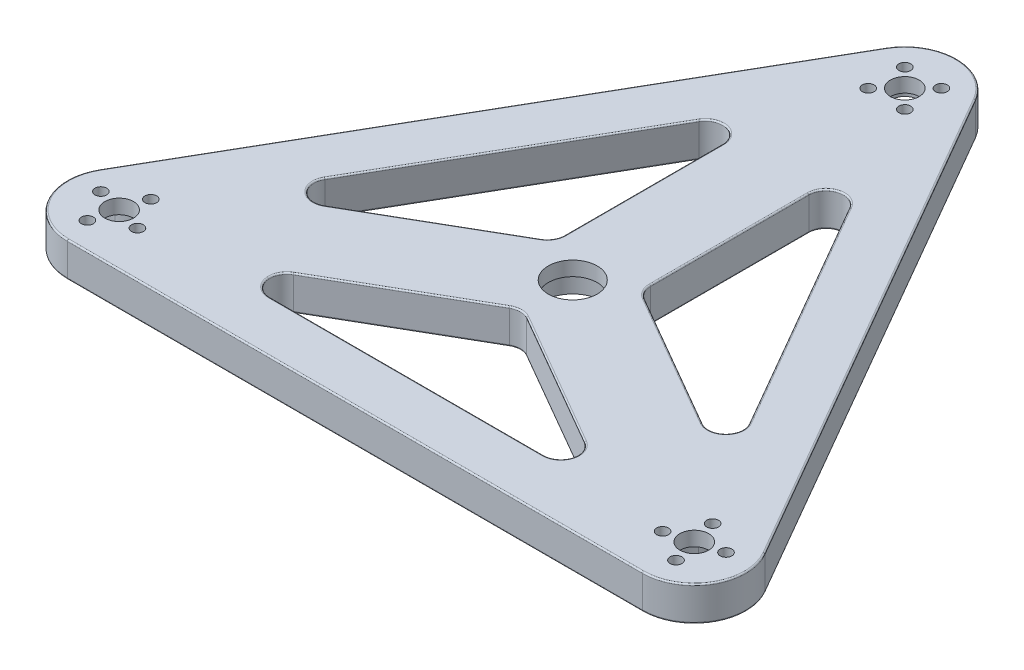
from build123d import *

# Parameters (mm, degrees)
SKETCH1_R           = 5
SKETCH1_R_2         = 8.5
SKETCH1_R_3         = 2.05
BOSS_EXTRUDE1_DEPTH = 12
SKETCH1_3_R         = 5
SKETCH1_3_R_2       = 2.05
SKETCH1_3_R_3       = 11
SKETCH1_3_R_4       = 8.5
CUT_EXTRUDE1_DEPTH  = 7
FILLET1_R           = 6
FILLET2_R           = 0.5


with BuildPart() as part:
    # Sketch1 → Boss-Extrude1 (new body)
    with BuildSketch(Plane(origin=(0, 0, 0), x_dir=(1, 0, 0), z_dir=(0, 1, 0))):
        with BuildLine():
            ThreePointArc((15.588457268, 124.470053838), (0, 133.470053838), (-15.588457268, 124.470053838))
            Line((-15.588457268, 124.470053838), (-115.588457268, -48.735026919))
            ThreePointArc((-115.588457268, -48.735026919), (-115.588457268, -66.735026919), (-100, -75.735026919))
            Line((-100, -75.735026919), (100, -75.735026919))
            ThreePointArc((100, -75.735026919), (115.588457268, -66.735026919), (115.588457268, -48.735026919))
            Line((115.588457268, -48.735026919), (15.588457268, 124.470053838))
        make_face()
        Polygon((70, -57.735026919), (-70, -57.735026919), (0, -17.320508076), align=None, mode=Mode.SUBTRACT)
        Polygon((-85, -31.754264805), (-15, 89.489291724), (-15, 8.660254038), align=None, mode=Mode.SUBTRACT)
        Polygon((15, 8.660254038), (15, 89.489291724), (85, -31.754264805), align=None, mode=Mode.SUBTRACT)
        with Locations((-100, -57.735026919)):
            Circle(SKETCH1_R, mode=Mode.SUBTRACT)
        Circle(SKETCH1_R_2, mode=Mode.SUBTRACT)
        with Locations((100, -57.735026919)):
            Circle(SKETCH1_R, mode=Mode.SUBTRACT)
        with Locations((0, 115.470053838)):
            Circle(SKETCH1_R, mode=Mode.SUBTRACT)
        with Locations((-91.306667563, -60.064398325)):
            Circle(SKETCH1_R_3, mode=Mode.SUBTRACT)
        with Locations((-97.670628594, -49.041694482)):
            Circle(SKETCH1_R_3, mode=Mode.SUBTRACT)
        with Locations((-102.329371406, -66.428359356)):
            Circle(SKETCH1_R_3, mode=Mode.SUBTRACT)
        with Locations((-108.693332437, -55.405655513)):
            Circle(SKETCH1_R_3, mode=Mode.SUBTRACT)
        with Locations((108.693332437, -55.405655513)):
            Circle(SKETCH1_R_3, mode=Mode.SUBTRACT)
        with Locations((97.670628594, -49.041694482)):
            Circle(SKETCH1_R_3, mode=Mode.SUBTRACT)
        with Locations((102.329371406, -66.428359356)):
            Circle(SKETCH1_R_3, mode=Mode.SUBTRACT)
        with Locations((91.306667563, -60.064398325)):
            Circle(SKETCH1_R_3, mode=Mode.SUBTRACT)
        with Locations((-6.363961031, 109.106092807)):
            Circle(SKETCH1_R_3, mode=Mode.SUBTRACT)
        with Locations((6.363961031, 109.106092807)):
            Circle(SKETCH1_R_3, mode=Mode.SUBTRACT)
        with Locations((6.363961031, 121.834014869)):
            Circle(SKETCH1_R_3, mode=Mode.SUBTRACT)
        with Locations((-6.363961031, 121.834014869)):
            Circle(SKETCH1_R_3, mode=Mode.SUBTRACT)
    extrude(amount=BOSS_EXTRUDE1_DEPTH)

    # Sketch1<3> → Cut-Extrude1 (cut)
    # profile 1 of 4: a face of its own
    with BuildSketch(Plane(origin=(0, 0, 0), x_dir=(1, 0, 0), z_dir=(0, 1, 0))):
        with BuildLine():
            ThreePointArc((3.737372338, 105.452186426), (9.545941546, 105.924112292), (10.017867412, 111.7326815))
            ThreePointArc((10.017867412, 111.7326815), (8.813961031, 115.470053838), (10.017867412, 119.207426176))
            ThreePointArc((10.017867412, 119.207426176), (9.545941546, 125.015995384), (3.737372338, 125.48792125))
            ThreePointArc((3.737372338, 125.48792125), (0, 124.284014869), (-3.737372338, 125.48792125))
            ThreePointArc((-3.737372338, 125.48792125), (-9.545941546, 125.015995384), (-10.017867412, 119.207426176))
            ThreePointArc((-10.017867412, 119.207426176), (-8.813961031, 115.470053838), (-10.017867412, 111.7326815))
            ThreePointArc((-10.017867412, 111.7326815), (-9.545941546, 105.924112292), (-3.737372338, 105.452186426))
            ThreePointArc((-3.737372338, 105.452186426), (0, 106.656092807), (3.737372338, 105.452186426))
        make_face()
        with Locations((0, 115.470053838)):
            Circle(SKETCH1_3_R, mode=Mode.SUBTRACT)
        with Locations((6.363961031, 109.106092807)):
            Circle(SKETCH1_3_R_2, mode=Mode.SUBTRACT)
        with Locations((6.363961031, 121.834014869)):
            Circle(SKETCH1_3_R_2, mode=Mode.SUBTRACT)
        with Locations((-6.363961031, 109.106092807)):
            Circle(SKETCH1_3_R_2, mode=Mode.SUBTRACT)
        with Locations((-6.363961031, 121.834014869)):
            Circle(SKETCH1_3_R_2, mode=Mode.SUBTRACT)
    # profile 2 of 4: a face of its own
    with BuildSketch(Plane(origin=(0, 0, 0), x_dir=(1, 0, 0), z_dir=(0, 1, 0))):
        Circle(SKETCH1_3_R_3)
        Circle(SKETCH1_3_R_4, mode=Mode.SUBTRACT)
    # profile 3 of 4: a face of its own
    with BuildSketch(Plane(origin=(0, 0, 0), x_dir=(1, 0, 0), z_dir=(0, 1, 0))):
        with BuildLine():
            ThreePointArc((93.192958499, -49.489433825), (92.366885839, -53.328046404), (89.45558616, -55.962752602))
            ThreePointArc((89.45558616, -55.962752602), (86.960001345, -61.229084028), (91.754406906, -64.54206842))
            ThreePointArc((91.754406906, -64.54206842), (95.593019485, -65.368141079), (98.227725683, -68.279440758))
            ThreePointArc((98.227725683, -68.279440758), (103.494057109, -70.775025574), (106.807041501, -65.980620013))
            ThreePointArc((106.807041501, -65.980620013), (107.633114161, -62.142007434), (110.54441384, -59.507301236))
            ThreePointArc((110.54441384, -59.507301236), (113.039998655, -54.24096981), (108.245593094, -50.927985418))
            ThreePointArc((108.245593094, -50.927985418), (104.406980515, -50.101912758), (101.772274317, -47.190613079))
            ThreePointArc((101.772274317, -47.190613079), (96.505942891, -44.695028264), (93.192958499, -49.489433825))
        make_face()
        with Locations((91.306667563, -60.064398325)):
            Circle(SKETCH1_3_R_2, mode=Mode.SUBTRACT)
        with Locations((100, -57.735026919)):
            Circle(SKETCH1_3_R, mode=Mode.SUBTRACT)
        with Locations((102.329371406, -66.428359356)):
            Circle(SKETCH1_3_R_2, mode=Mode.SUBTRACT)
        with Locations((97.670628594, -49.041694482)):
            Circle(SKETCH1_3_R_2, mode=Mode.SUBTRACT)
        with Locations((108.693332437, -55.405655513)):
            Circle(SKETCH1_3_R_2, mode=Mode.SUBTRACT)
    # profile 4 of 4: a face of its own
    with BuildSketch(Plane(origin=(0, 0, 0), x_dir=(1, 0, 0), z_dir=(0, 1, 0))):
        with BuildLine():
            ThreePointArc((-101.772274317, -47.190613079), (-104.406980515, -50.101912758), (-108.245593094, -50.927985418))
            ThreePointArc((-108.245593094, -50.927985418), (-113.039998655, -54.24096981), (-110.54441384, -59.507301236))
            ThreePointArc((-110.54441384, -59.507301236), (-107.633114161, -62.142007434), (-106.807041501, -65.980620013))
            ThreePointArc((-106.807041501, -65.980620013), (-103.494057109, -70.775025574), (-98.227725683, -68.279440758))
            ThreePointArc((-98.227725683, -68.279440758), (-95.593019485, -65.368141079), (-91.754406906, -64.54206842))
            ThreePointArc((-91.754406906, -64.54206842), (-86.960001345, -61.229084028), (-89.45558616, -55.962752602))
            ThreePointArc((-89.45558616, -55.962752602), (-92.366885839, -53.328046404), (-93.192958499, -49.489433825))
            ThreePointArc((-93.192958499, -49.489433825), (-96.505942891, -44.695028264), (-101.772274317, -47.190613079))
        make_face()
        with Locations((-108.693332437, -55.405655513)):
            Circle(SKETCH1_3_R_2, mode=Mode.SUBTRACT)
        with Locations((-100, -57.735026919)):
            Circle(SKETCH1_3_R, mode=Mode.SUBTRACT)
        with Locations((-102.329371406, -66.428359356)):
            Circle(SKETCH1_3_R_2, mode=Mode.SUBTRACT)
        with Locations((-97.670628594, -49.041694482)):
            Circle(SKETCH1_3_R_2, mode=Mode.SUBTRACT)
        with Locations((-91.306667563, -60.064398325)):
            Circle(SKETCH1_3_R_2, mode=Mode.SUBTRACT)
    extrude(amount=CUT_EXTRUDE1_DEPTH, mode=Mode.SUBTRACT)

    # Fillet1
    fillet1_edges = [part.edges().sort_by_distance(p)[0] for p in [
        (70, 6, 57.735026919),
        (85, 6, 31.754264805),
        (-15, 6, -8.660254038),
        (-85, 6, 31.754264805),
        (-70, 6, 57.735026919),
        (15, 6, -8.660254038),
        (15, 6, -89.489291724),
        (-15, 6, -89.489291724),
        (0, 6, 17.320508076),
    ]]
    fillet(fillet1_edges, radius=FILLET1_R)

    # Fillet2
    fillet2_edges = [part.edges().sort_by_distance(p)[0] for p in [
        (0, 0, 18.248711306),
        (26.803847577, 0, 32.79571669),
        (53.403250112, 0, 53.28794119),
        (0, 0, 57.735026919),
        (-53.403250112, 0, 53.28794119),
        (0, 12, 18.248711306),
        (26.803847577, 12, 32.79571669),
        (53.403250112, 12, 53.28794119),
        (0, 12, 57.735026919),
        (-53.403250112, 12, 53.28794119),
        (-19.447085729, 12, -72.892541837),
        (-15, 12, -39.610671266),
        (-15.803847577, 12, -9.124355653),
        (-41.803847577, 12, 6.814954576),
        (-72.850335842, 12, 19.604600647),
        (-72.850335842, 0, 19.604600647),
        (-50, 0, -28.867513459),
        (-19.447085729, 0, -72.892541837),
        (-15, 0, -39.610671266),
        (-15.803847577, 0, -9.124355653),
        (72.850335842, 12, 19.604600647),
        (50, 12, -28.867513459),
        (19.447085729, 12, -72.892541837),
        (15, 12, -39.610671266),
        (15.803847577, 12, -9.124355653),
        (72.850335842, 0, 19.604600647),
        (50, 0, -28.867513459),
        (19.447085729, 0, -72.892541837),
        (15, 0, -39.610671266),
        (15.803847577, 0, -9.124355653),
        (115.588457268, 12, 66.735026919),
        (0, 12, 75.735026919),
        (-115.588457268, 12, 66.735026919),
        (-65.588457268, 12, -37.867513459),
        (0, 12, -133.470053838),
        (115.588457268, 0, 66.735026919),
        (0, 0, 75.735026919),
        (-115.588457268, 0, 66.735026919),
        (-65.588457268, 0, -37.867513459),
        (0, 0, -133.470053838),
        (-26.803847577, 0, 32.79571669),
        (-26.803847577, 12, 32.79571669),
        (-50, 12, -28.867513459),
        (-41.803847577, 0, 6.814954576),
        (41.803847577, 12, 6.814954576),
        (41.803847577, 0, 6.814954576),
        (65.588457268, 12, -37.867513459),
        (65.588457268, 0, -37.867513459),
    ]]
    fillet(fillet2_edges, radius=FILLET2_R)


solid = part.part
